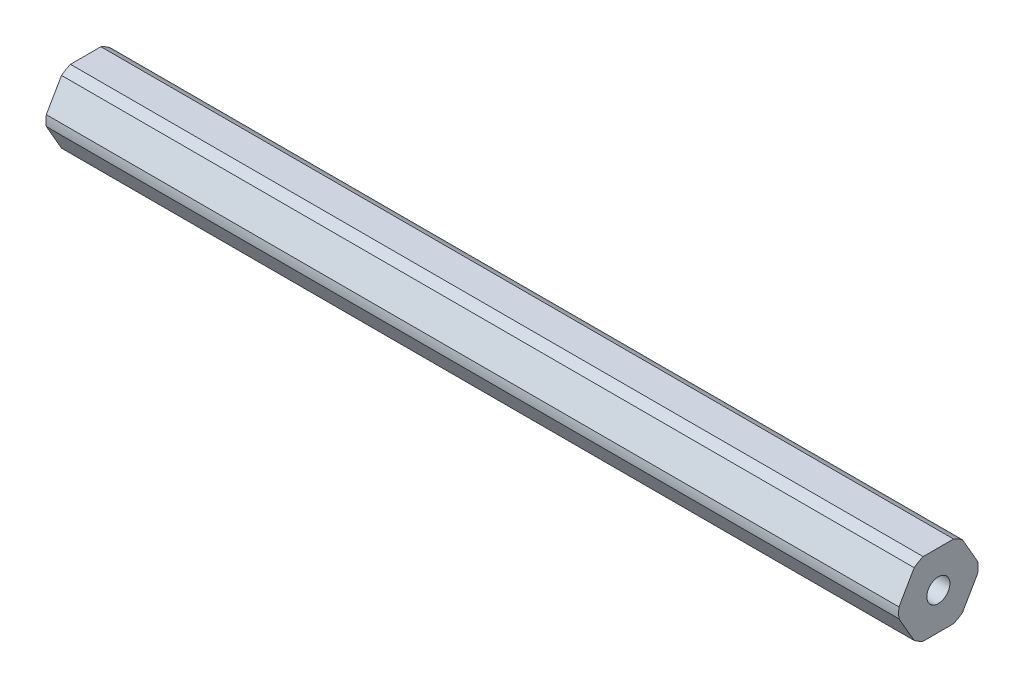
from build123d import *

# Parameters (mm, degrees)
SKETCH1_R           = 2.000000064
BOSS_EXTRUDE1_DEPTH = 73.81875


with BuildPart() as part:
    # Sketch1 → Boss-Extrude1 (new, symmetric)
    with BuildSketch(Plane(origin=(0, 0, 0), x_dir=(0, 0, -1), z_dir=(1, 0, 0))):
        with BuildLine():
            ThreePointArc((6.874999966, 0), (6.860422465, 0.447468582), (6.816751782, 0.893039571))
            Line((6.816751782, 0.893039571), (4.181770846, 5.456960429))
            ThreePointArc((4.181770846, 5.456960429), (3.437499983, 5.953924622), (2.634980936, 6.35))
            Line((2.634980936, 6.35), (-2.634980936, 6.35))
            ThreePointArc((-2.634980936, 6.35), (-3.437499983, 5.953924622), (-4.181770846, 5.456960429))
            Line((-4.181770846, 5.456960429), (-6.816751782, 0.893039571))
            ThreePointArc((-6.816751782, 0.893039571), (-6.874999966, 0), (-6.816751782, -0.893039571))
            Line((-6.816751782, -0.893039571), (-4.181770846, -5.456960429))
            ThreePointArc((-4.181770846, -5.456960429), (-3.437499983, -5.953924622), (-2.634980936, -6.35))
            Line((-2.634980936, -6.35), (2.634980936, -6.35))
            ThreePointArc((2.634980936, -6.35), (3.437499983, -5.953924622), (4.181770846, -5.456960429))
            Line((4.181770846, -5.456960429), (6.816751782, -0.893039571))
            ThreePointArc((6.816751782, -0.893039571), (6.860422465, -0.447468582), (6.874999966, 0))
        make_face()
        Circle(SKETCH1_R, mode=Mode.SUBTRACT)
    extrude(amount=BOSS_EXTRUDE1_DEPTH, both=True)


solid = part.part
